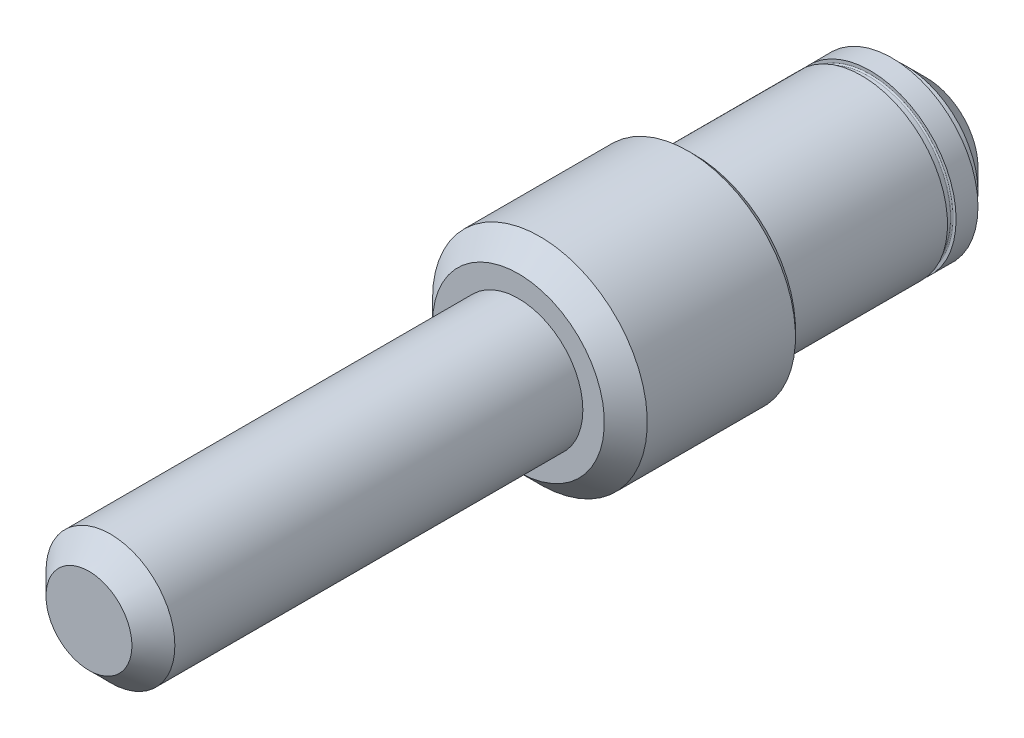
from build123d import *

# Parameters (mm, degrees)
CHAMFER_1_SIZE      = 5
SKETCH_4_R          = 20
SKETCH_4_R_2        = 19
CUT_EXTRUDE_1_DEPTH = 2
FILLET_1_R          = 0.3
CHAMFER_2_SIZE      = 1.5
SKETCH_9_R          = 25
SKETCH_9_R_2        = 20
CUT_EXTRUDE_4_DEPTH = 6
CHAMFER_3_SIZE      = 1.5


with BuildPart() as part:
    # Эскиз1 → Повернуть1 (revolve)
    with BuildSketch(Plane(origin=(0, 0, 0), x_dir=(0, 0, -1), z_dir=(1, 0, 0)), mode=Mode.PRIVATE) as revolve_1_sk:
        Polygon((0, 0), (0, 15), (100, 15), (100, 25), (147, 25), (147, 20), (187, 20), (187, 17), (195, 17), (195, 5), (190, 0), align=None)
    revolve(revolve_1_sk.sketch.rotate(Axis((0, 0, 0), (0, 0, -1)), 90), axis=Axis((0, 0, 0), (0, 0, -1)))

    # Фаска1
    chamfer_1_edges = [part.edges().sort_by_distance(p)[0] for p in [
        (-25, 0, -100),
        (-15, 0, 0),
        (-17, 0, -195),
    ]]
    chamfer(chamfer_1_edges, length=CHAMFER_1_SIZE)

    # Эскиз4 → Вырез-Вытянуть1 (cut)
    with BuildSketch(Plane(origin=(0, 0, -181.9), x_dir=(-1, 0, 0), z_dir=(0, 0, -1))):
        with Locations(Location((0, 0, 0), (0, 0, 180))):
            Circle(SKETCH_4_R)
        Circle(SKETCH_4_R_2, mode=Mode.SUBTRACT)
    extrude(amount=-CUT_EXTRUDE_1_DEPTH, mode=Mode.SUBTRACT)

    # Скругление1
    fillet_1_edges = [part.edges().sort_by_distance(p)[0] for p in [
        (19, 0, -179.9),
        (19, 0, -181.9),
    ]]
    fillet(fillet_1_edges, radius=FILLET_1_R)

    # Фаска2
    chamfer_2_edges = [part.edges().sort_by_distance(p)[0] for p in [
        (-25, 0, -147),
    ]]
    chamfer(chamfer_2_edges, length=CHAMFER_2_SIZE)

    # Эскиз9 → Вырез-Вытянуть4 (cut)
    with BuildSketch(Plane(origin=(0, 0, -147), x_dir=(-1, 0, 0), z_dir=(0, 0, -1))):
        Circle(SKETCH_9_R)
        Circle(SKETCH_9_R_2, mode=Mode.SUBTRACT)
    extrude(amount=-CUT_EXTRUDE_4_DEPTH, mode=Mode.SUBTRACT)

    # Фаска3
    chamfer_3_edges = [part.edges().sort_by_distance(p)[0] for p in [
        (-25, 0, -141),
    ]]
    chamfer(chamfer_3_edges, length=CHAMFER_3_SIZE)


solid = part.part
